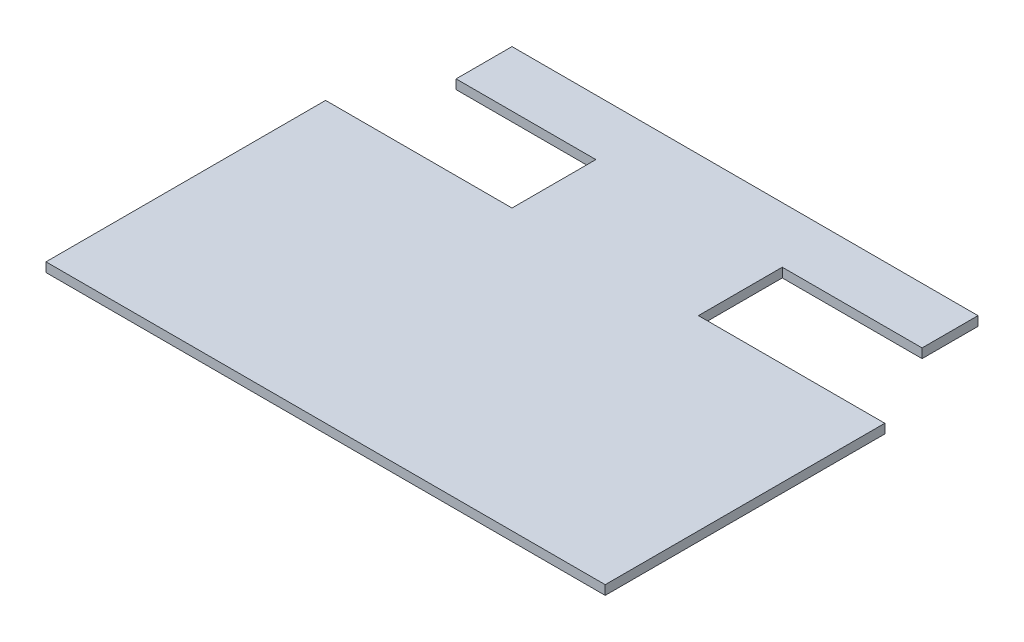
from build123d import *

# Parameters (mm, degrees)
BOSS_EXTRUDE1_DEPTH = 5


with BuildPart() as part:
    # Sketch1 → Boss-Extrude1 (new body)
    with BuildSketch(Plane(origin=(0, 0, 0), x_dir=(1, 0, 0), z_dir=(0, 1, 0))):
        Polygon((150, 0), (-150, 0), (-150, 150), (-50, 150), (-50, 195), (-125, 195), (-125, 225), (125, 225), (125, 195), (50, 195), (50, 150), (150, 150), align=None)
    extrude(amount=BOSS_EXTRUDE1_DEPTH)


solid = part.part
